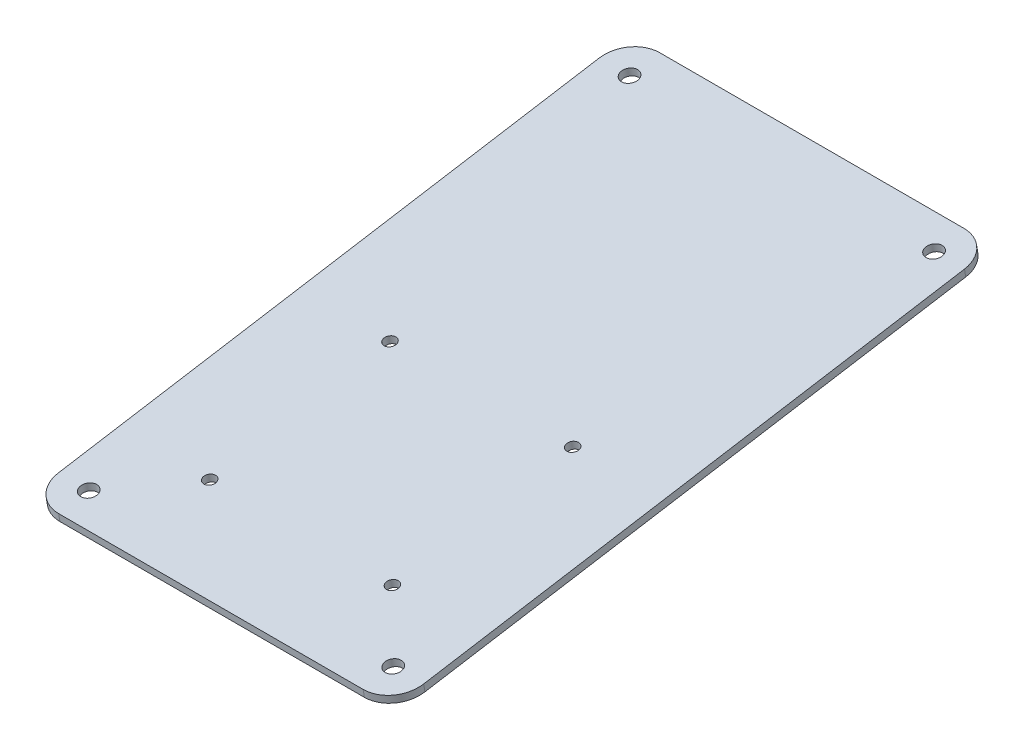
from build123d import *

# Parameters (mm, degrees)
BOSS_EXTRUDE1_DEPTH          = 3.175
F_1_4_CLEARANCE_HOLE1_D      = 6.7564
F_10_0_1935_DIAMETER_HOLE1_D = 4.9149


with BuildPart() as part:
    # Sketch1 → Boss-Extrude1 (new body)
    with BuildSketch(Plane(origin=(0, 687.523670024, 112.992800714), x_dir=(1, 0, 0), z_dir=(0, 0.9867625124381891, 0.16217195826243377))):
        with BuildLine():
            Line((-76.2, -1167.779230682), (-76.2, -939.179230682))
            ThreePointArc((-76.2, -939.179230682), (-72.480256121, -930.198974561), (-63.5, -926.479230682))
            Line((-63.5, -926.479230682), (63.5, -926.479230682))
            ThreePointArc((63.5, -926.479230682), (72.480256121, -930.198974561), (76.2, -939.179230682))
            Line((76.2, -939.179230682), (76.2, -1167.779230682))
            ThreePointArc((76.2, -1167.779230682), (72.480256121, -1176.759486803), (63.5, -1180.479230682))
            Line((63.5, -1180.479230682), (-63.5, -1180.479230682))
            ThreePointArc((-63.5, -1180.479230682), (-72.480256121, -1176.759486803), (-76.2, -1167.779230682))
        make_face()
    extrude(amount=BOSS_EXTRUDE1_DEPTH)

    # 1/4 Clearance Hole1 (through all)
    with Locations(Plane(origin=(0, 690.656641001, 113.507696681), x_dir=(1, 0, 0), z_dir=(0, 0.9867625124381894, 0.16217195826243377))):
        with Locations((-63.5, -1167.779230682), (63.5, -1167.779230682), (63.5, -939.179230682), (-63.5, -939.179230682)):
            Hole(F_1_4_CLEARANCE_HOLE1_D / 2)

    # #10 (0.1935) Diameter Hole1 (through all)
    with Locations(Plane(origin=(0, 690.656641001, 113.507696681), x_dir=(1, 0, 0), z_dir=(0, 0.9867625124381891, 0.1621719582624338))):
        with Locations((38.1, -1142.379230682), (-38.1, -1142.379230682), (38.1, -1066.179230682), (-38.1, -1066.179230682)):
            Hole(F_10_0_1935_DIAMETER_HOLE1_D / 2)


solid = part.part
